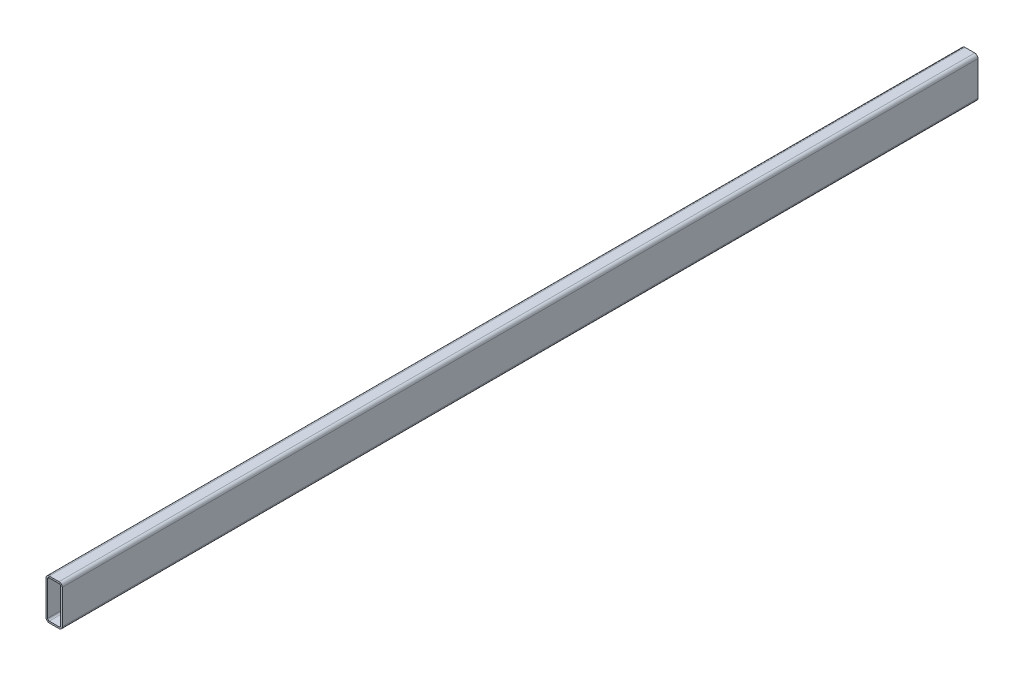
from build123d import *

# Parameters (mm, degrees)
BOSS_EXTRUDE1_DEPTH = 562.5


with BuildPart() as part:
    # Sketch1 → Boss-Extrude1 (new, symmetric)
    with BuildSketch(Plane.XY):
        with BuildLine():
            Line((-10, 0), (-10, -21))
            ThreePointArc((-10, -21), (-8.828427125, -23.828427125), (-6, -25))
            Line((-6, -25), (0, -25))
            Line((0, -25), (6, -25))
            ThreePointArc((6, -25), (8.828427125, -23.828427125), (10, -21))
            Line((10, -21), (10, 0))
            Line((10, 0), (10, 21))
            ThreePointArc((10, 21), (8.828427125, 23.828427125), (6, 25))
            Line((6, 25), (-6, 25))
            ThreePointArc((-6, 25), (-8.828427125, 23.828427125), (-10, 21))
            Line((-10, 21), (-10, 0))
        make_face()
        with BuildLine():
            Line((-8, 0), (-8, -21))
            ThreePointArc((-8, -21), (-7.414213562, -22.414213562), (-6, -23))
            Line((-6, -23), (0, -23))
            Line((0, -23), (6, -23))
            ThreePointArc((6, -23), (7.414213562, -22.414213562), (8, -21))
            Line((8, -21), (8, 0))
            Line((8, 0), (8, 21))
            ThreePointArc((8, 21), (7.414213562, 22.414213562), (6, 23))
            Line((6, 23), (-6, 23))
            ThreePointArc((-6, 23), (-7.414213562, 22.414213562), (-8, 21))
            Line((-8, 21), (-8, 0))
        make_face(mode=Mode.SUBTRACT)
    extrude(amount=BOSS_EXTRUDE1_DEPTH, both=True)


solid = part.part
